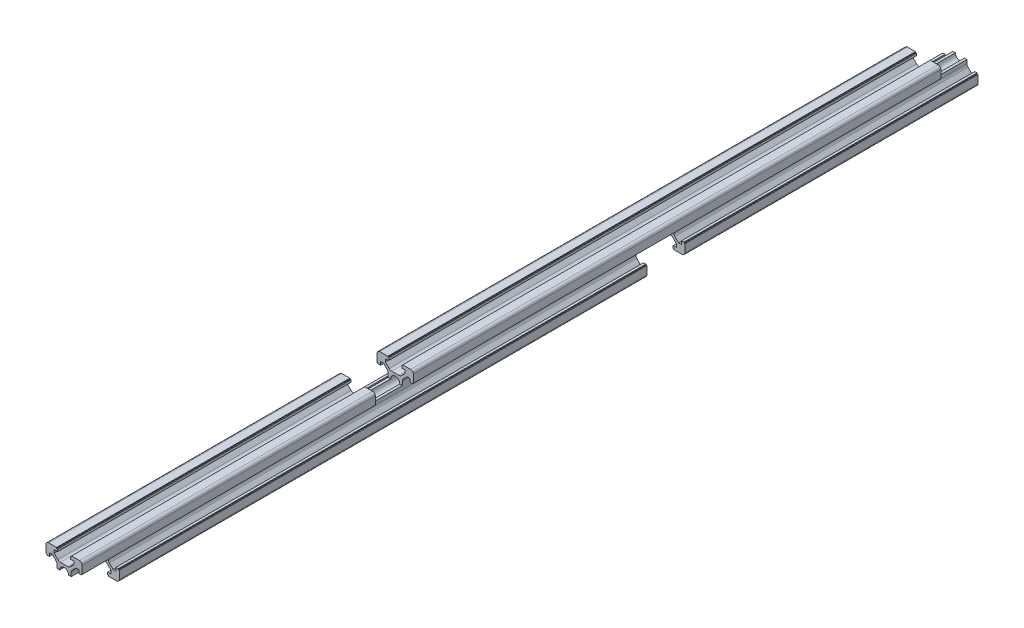
from build123d import *

# Parameters (mm, degrees)
SKETCH1_R           = 2.5
BOSS_EXTRUDE2_DEPTH = 495
SKETCH_1_W          = 21
SKETCH_1_H          = 10
SKETCH_1_W_2        = 20.5
CUT_EXTRUDE_1_DEPTH = 496.504793115


with BuildPart() as part:
    # Sketch1 → Boss-Extrude2 (new body)
    with BuildSketch(Plane.XY):
        with BuildLine():
            Line((10, -4.1), (10, -8.5))
            ThreePointArc((10, -8.5), (9.560660172, -9.560660172), (8.5, -10))
            Line((8.5, -10), (4.1, -10))
            Line((4.1, -10), (4.1, -9.5))
            Line((4.1, -9.5), (3.6, -9.5))
            Line((3.6, -9.5), (3.6, -8.2))
            Line((3.6, -8.2), (5.5, -8.2))
            Line((5.5, -8.2), (5.5, -6.560660172))
            Line((5.5, -6.560660172), (3.425126266, -4.485786438))
            ThreePointArc((3.425126266, -4.485786438), (2.776279568, -4.052240935), (2.010912703, -3.9))
            Line((2.010912703, -3.9), (-2.010912703, -3.9))
            ThreePointArc((-2.010912703, -3.9), (-2.776279568, -4.052240935), (-3.425126266, -4.485786438))
            Line((-3.425126266, -4.485786438), (-5.5, -6.560660172))
            Line((-5.5, -6.560660172), (-5.5, -8.2))
            Line((-5.5, -8.2), (-3.6, -8.2))
            Line((-3.6, -8.2), (-3.6, -9.5))
            Line((-3.6, -9.5), (-4.1, -9.5))
            Line((-4.1, -9.5), (-4.1, -10))
            Line((-4.1, -10), (-8.5, -10))
            ThreePointArc((-8.5, -10), (-9.560660172, -9.560660172), (-10, -8.5))
            Line((-10, -8.5), (-10, -4.1))
            Line((-10, -4.1), (-9.5, -4.1))
            Line((-9.5, -4.1), (-9.5, -3.6))
            Line((-9.5, -3.6), (-8.2, -3.6))
            Line((-8.2, -3.6), (-8.2, -5.5))
            Line((-8.2, -5.5), (-6.560660172, -5.5))
            Line((-6.560660172, -5.5), (-4.485786438, -3.425126266))
            ThreePointArc((-4.485786438, -3.425126266), (-4.052240935, -2.776279568), (-3.9, -2.010912703))
            Line((-3.9, -2.010912703), (-3.9, 2.010912703))
            ThreePointArc((-3.9, 2.010912703), (-4.052240935, 2.776279568), (-4.485786438, 3.425126266))
            Line((-4.485786438, 3.425126266), (-6.560660172, 5.5))
            Line((-6.560660172, 5.5), (-8.2, 5.5))
            Line((-8.2, 5.5), (-8.2, 3.6))
            Line((-8.2, 3.6), (-9.5, 3.6))
            Line((-9.5, 3.6), (-9.5, 4.1))
            Line((-9.5, 4.1), (-10, 4.1))
            Line((-10, 4.1), (-10, 8.5))
            ThreePointArc((-10, 8.5), (-9.560660172, 9.560660172), (-8.5, 10))
            Line((-8.5, 10), (-4.1, 10))
            Line((-4.1, 10), (-4.1, 9.5))
            Line((-4.1, 9.5), (-3.6, 9.5))
            Line((-3.6, 9.5), (-3.6, 8.2))
            Line((-3.6, 8.2), (-5.5, 8.2))
            Line((-5.5, 8.2), (-5.5, 6.560660172))
            Line((-5.5, 6.560660172), (-3.425126266, 4.485786438))
            ThreePointArc((-3.425126266, 4.485786438), (-2.776279568, 4.052240935), (-2.010912703, 3.9))
            Line((-2.010912703, 3.9), (2.010912703, 3.9))
            ThreePointArc((2.010912703, 3.9), (2.776279568, 4.052240935), (3.425126266, 4.485786438))
            Line((3.425126266, 4.485786438), (5.5, 6.560660172))
            Line((5.5, 6.560660172), (5.5, 8.2))
            Line((5.5, 8.2), (3.6, 8.2))
            Line((3.6, 8.2), (3.6, 9.5))
            Line((3.6, 9.5), (4.1, 9.5))
            Line((4.1, 9.5), (4.1, 10))
            Line((4.1, 10), (8.5, 10))
            ThreePointArc((8.5, 10), (9.560660172, 9.560660172), (10, 8.5))
            Line((10, 8.5), (10, 4.1))
            Line((10, 4.1), (9.5, 4.1))
            Line((9.5, 4.1), (9.5, 3.6))
            Line((9.5, 3.6), (8.2, 3.6))
            Line((8.2, 3.6), (8.2, 5.5))
            Line((8.2, 5.5), (6.560660172, 5.5))
            Line((6.560660172, 5.5), (4.485786438, 3.425126266))
            ThreePointArc((4.485786438, 3.425126266), (4.052240935, 2.776279568), (3.9, 2.010912703))
            Line((3.9, 2.010912703), (3.9, -2.010912703))
            ThreePointArc((3.9, -2.010912703), (4.052240935, -2.776279568), (4.485786438, -3.425126266))
            Line((4.485786438, -3.425126266), (6.560660172, -5.5))
            Line((6.560660172, -5.5), (8.2, -5.5))
            Line((8.2, -5.5), (8.2, -3.6))
            Line((8.2, -3.6), (9.5, -3.6))
            Line((9.5, -3.6), (9.5, -4.1))
            Line((9.5, -4.1), (10, -4.1))
        make_face()
        Circle(SKETCH1_R, mode=Mode.SUBTRACT)
    extrude(amount=BOSS_EXTRUDE2_DEPTH)

    # ｽｹｯﾁ1 → ｶｯﾄ - 押し出し1 (cut, through all)
    with BuildSketch(Plane.ZY.offset(10)):
        with Locations((172.5, -5)):
            Rectangle(SKETCH_1_W, SKETCH_1_H)
        with Locations((10.25, 5)):
            Rectangle(SKETCH_1_W_2, SKETCH_1_H)
        with Locations((484.75, -5)):
            Rectangle(SKETCH_1_W_2, SKETCH_1_H)
        with Locations((322.5, 5)):
            Rectangle(SKETCH_1_W, SKETCH_1_H)
    extrude(amount=-CUT_EXTRUDE_1_DEPTH, mode=Mode.SUBTRACT)


solid = part.part
